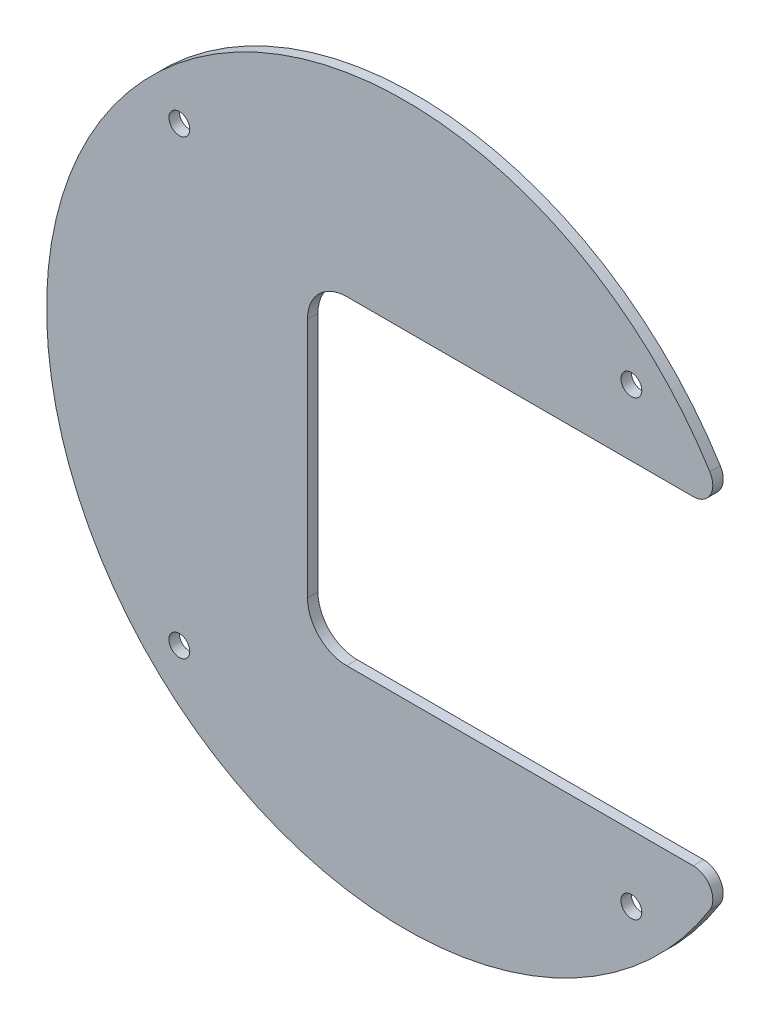
from build123d import *

# Parameters (mm, degrees)
SKETCH_1_R      = 1.6
EXTRUDE_1_DEPTH = 1.6
FILLET_1_R      = 6
FILLET_2_R      = 3


with BuildPart() as part:
    # 草圖1 → 填料-伸長1 (new body)
    with BuildSketch(Plane.XY):
        with BuildLine():
            Line((49.241750578, -24.5), (-15, -24.5))
            Line((-15, -24.5), (-15, 24.5))
            Line((-15, 24.5), (49.241750578, 24.5))
            ThreePointArc((49.241750578, 24.5), (-55, 0), (49.241750578, -24.5))
        make_face()
        with Locations((34.648232278, 34.648232278)):
            Circle(SKETCH_1_R, mode=Mode.SUBTRACT)
        with Locations((-34.648232278, 34.648232278)):
            Circle(SKETCH_1_R, mode=Mode.SUBTRACT)
        with Locations((-34.648232278, -34.648232278)):
            Circle(SKETCH_1_R, mode=Mode.SUBTRACT)
        with Locations((34.648232278, -34.648232278)):
            Circle(SKETCH_1_R, mode=Mode.SUBTRACT)
    extrude(amount=EXTRUDE_1_DEPTH)

    # 圓角1
    fillet_1_edges = [part.edges().sort_by_distance(p)[0] for p in [
        (-15, 24.5, 0.8),
        (-15, -24.5, 0.8),
    ]]
    fillet(fillet_1_edges, radius=FILLET_1_R)

    # 圓角2
    fillet_2_edges = [part.edges().sort_by_distance(p)[0] for p in [
        (49.241750578, 24.5, 0.8),
        (49.241750578, -24.5, 0.8),
    ]]
    fillet(fillet_2_edges, radius=FILLET_2_R)


solid = part.part
